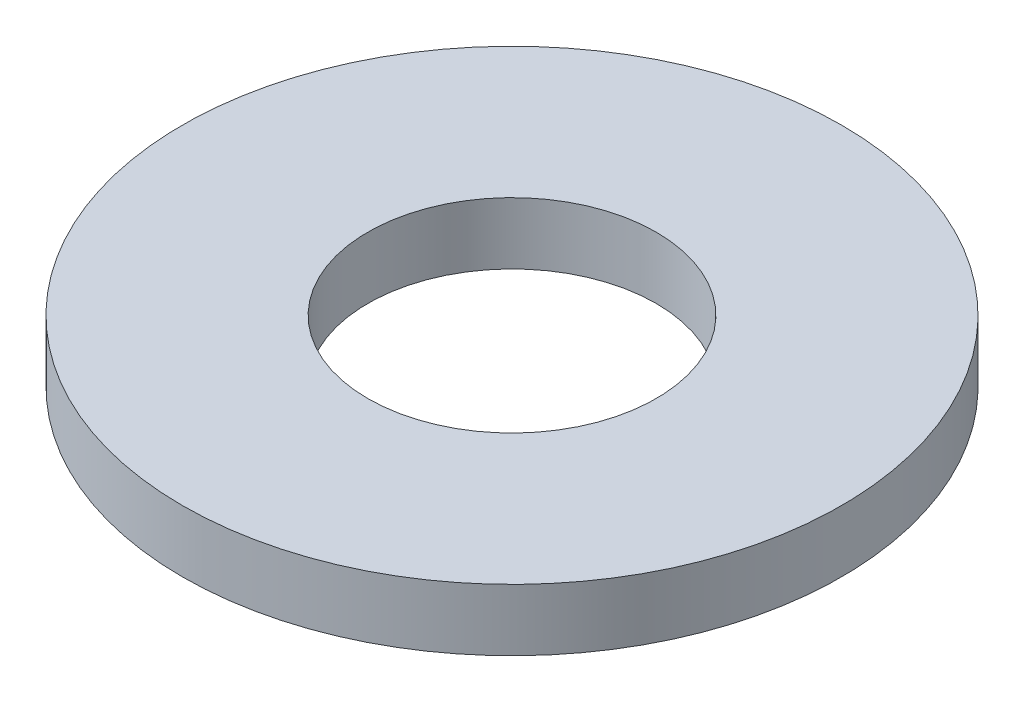
from build123d import *

# Parameters (mm, degrees)
SKETCH1_R      = 8.128
SKETCH1_R_2    = 3.556
EXTRUDE1_DEPTH = 1.524


with BuildPart() as part:
    # Sketch1 → Extrude1 (new body)
    with BuildSketch(Plane(origin=(0, 0, 0), x_dir=(1, 0, 0), z_dir=(0, 1, 0))):
        with Locations(Location((0, 0, 0), (0, 0, 90))):
            Circle(SKETCH1_R)
        with Locations(Location((0, 0, 0), (0, 0, 90))):
            Circle(SKETCH1_R_2, mode=Mode.SUBTRACT)
    extrude(amount=EXTRUDE1_DEPTH)


solid = part.part
